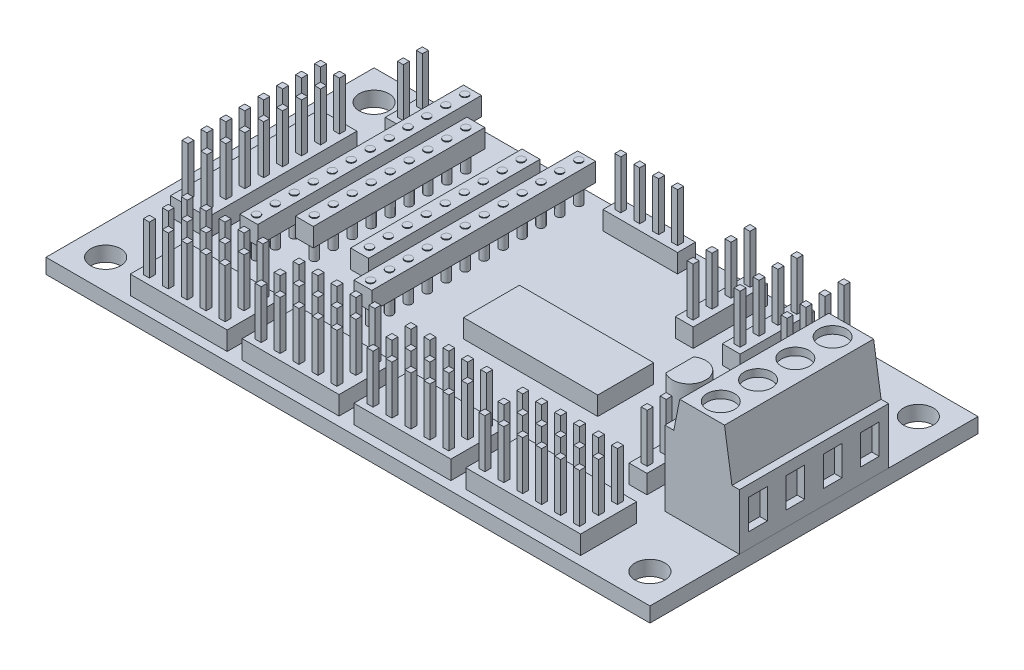
from build123d import *

# Parameters (mm, degrees)
ESQUISSE1_W                = 81
ESQUISSE1_H                = 44
ESQUISSE1_R                = 2
BOSS_EXTRU_1_DEPTH         = 2
BOSS_EXTRU_3_DEPTH         = 10
ESQUISSE5_R                = 1.85
ENL_V_MAT_EXTRU_1_DEPTH    = 1
ESQUISSE6_W                = 2.5
ESQUISSE6_H                = 4
ENL_V_MAT_EXTRU_2_DEPTH    = 1
ESQUISSE4_W                = 5
ESQUISSE4_H                = 20
BOSS_EXTRU_4_DEPTH         = 2.5
ESQUISSE4_W_2              = 2.4
ESQUISSE4_H_2              = 5
BOSS_EXTRU_4_2_DEPTH       = 2.5
ESQUISSE4_H_3              = 30
BOSS_EXTRU_4_3_DEPTH       = 2.5
ESQUISSE4_H_4              = 23
BOSS_EXTRU_4_4_DEPTH       = 2.5
ESQUISSE4_W_3              = 10
ESQUISSE4_H_5              = 2.4
BOSS_EXTRU_4_5_DEPTH       = 2.5
ESQUISSE4_H_6              = 10
BOSS_EXTRU_4_6_DEPTH       = 2.5
BOSS_EXTRU_4_7_DEPTH       = 2.5
BOSS_EXTRU_4_8_DEPTH       = 2.5
ESQUISSE4_W_4              = 13
ESQUISSE4_H_7              = 7.5
BOSS_EXTRU_4_9_DEPTH       = 2.5
BOSS_EXTRU_4_10_DEPTH      = 2.5
BOSS_EXTRU_4_11_DEPTH      = 2.5
ESQUISSE4_W_5              = 15.4
BOSS_EXTRU_4_12_DEPTH      = 2.5
ESQUISSE4_W_6              = 18
BOSS_EXTRU_4_13_DEPTH      = 2.5
BOSS_EXTRU_4_14_DEPTH      = 2.5
BOSS_EXTRU_4_15_DEPTH      = 2.5
BOSS_EXTRU_4_16_DEPTH      = 2.5
BOSS_EXTRU_5_START         = 0.1
ESQUISSE7_R                = 0.5
BOSS_EXTRU_5_DEPTH         = 8
BOSS_EXTRU_5_2_DEPTH       = 8
BOSS_EXTRU_5_3_DEPTH       = 8
BOSS_EXTRU_5_4_DEPTH       = 8
BOSS_EXTRU_5_5_DEPTH       = 8
BOSS_EXTRU_5_6_DEPTH       = 8
BOSS_EXTRU_5_7_DEPTH       = 8
BOSS_EXTRU_5_8_DEPTH       = 8
BOSS_EXTRU_5_9_DEPTH       = 8
BOSS_EXTRU_5_10_DEPTH      = 8
BOSS_EXTRU_5_11_DEPTH      = 8
BOSS_EXTRU_5_12_DEPTH      = 8
BOSS_EXTRU_5_13_DEPTH      = 8
BOSS_EXTRU_5_14_DEPTH      = 8
BOSS_EXTRU_5_15_DEPTH      = 8
BOSS_EXTRU_5_16_DEPTH      = 8
BOSS_EXTRU_5_17_DEPTH      = 8
BOSS_EXTRU_5_18_DEPTH      = 8
BOSS_EXTRU_5_19_DEPTH      = 8
BOSS_EXTRU_5_20_DEPTH      = 8
BOSS_EXTRU_5_21_DEPTH      = 8
BOSS_EXTRU_5_22_DEPTH      = 8
BOSS_EXTRU_5_23_DEPTH      = 8
BOSS_EXTRU_5_24_DEPTH      = 8
BOSS_EXTRU_5_25_DEPTH      = 8
BOSS_EXTRU_5_26_DEPTH      = 8
BOSS_EXTRU_5_27_DEPTH      = 8
BOSS_EXTRU_5_28_DEPTH      = 8
BOSS_EXTRU_5_29_DEPTH      = 8
BOSS_EXTRU_5_30_DEPTH      = 8
BOSS_EXTRU_5_31_DEPTH      = 8
BOSS_EXTRU_5_32_DEPTH      = 8
BOSS_EXTRU_5_33_DEPTH      = 8
BOSS_EXTRU_5_34_DEPTH      = 8
BOSS_EXTRU_5_35_DEPTH      = 8
BOSS_EXTRU_5_36_DEPTH      = 8
BOSS_EXTRU_5_37_DEPTH      = 8
BOSS_EXTRU_5_38_DEPTH      = 8
BOSS_EXTRU_5_39_DEPTH      = 8
BOSS_EXTRU_5_40_DEPTH      = 8
BOSS_EXTRU_5_41_DEPTH      = 8
BOSS_EXTRU_5_42_DEPTH      = 8
BOSS_EXTRU_6_DEPTH         = 8
BOSS_EXTRU_7_START         = 9
ESQUISSE9_W                = 0.8
ESQUISSE9_H                = 0.8
BOSS_EXTRU_7_DEPTH         = 12
BOSS_EXTRU_7_2_DEPTH       = 12
BOSS_EXTRU_7_3_DEPTH       = 12
BOSS_EXTRU_7_4_DEPTH       = 12
BOSS_EXTRU_7_5_DEPTH       = 12
BOSS_EXTRU_7_6_DEPTH       = 12
BOSS_EXTRU_7_7_DEPTH       = 12
BOSS_EXTRU_7_8_DEPTH       = 12
BOSS_EXTRU_7_9_DEPTH       = 12
BOSS_EXTRU_7_10_DEPTH      = 12
BOSS_EXTRU_7_11_DEPTH      = 12
BOSS_EXTRU_7_12_DEPTH      = 12
BOSS_EXTRU_7_13_DEPTH      = 12
BOSS_EXTRU_7_14_DEPTH      = 12
BOSS_EXTRU_7_15_DEPTH      = 12
BOSS_EXTRU_7_16_DEPTH      = 12
BOSS_EXTRU_7_17_DEPTH      = 12
BOSS_EXTRU_7_18_DEPTH      = 12
BOSS_EXTRU_7_19_DEPTH      = 12
BOSS_EXTRU_7_20_DEPTH      = 12
BOSS_EXTRU_7_21_DEPTH      = 12
BOSS_EXTRU_7_22_DEPTH      = 12
BOSS_EXTRU_7_23_DEPTH      = 12
BOSS_EXTRU_7_24_DEPTH      = 12
BOSS_EXTRU_7_25_DEPTH      = 12
BOSS_EXTRU_7_26_DEPTH      = 12
BOSS_EXTRU_7_27_DEPTH      = 12
BOSS_EXTRU_7_28_DEPTH      = 12
BOSS_EXTRU_7_29_DEPTH      = 12
BOSS_EXTRU_7_30_DEPTH      = 12
BOSS_EXTRU_7_31_DEPTH      = 12
BOSS_EXTRU_7_32_DEPTH      = 12
BOSS_EXTRU_7_33_DEPTH      = 12
BOSS_EXTRU_7_34_DEPTH      = 12
BOSS_EXTRU_7_35_DEPTH      = 12
BOSS_EXTRU_7_36_DEPTH      = 12
BOSS_EXTRU_7_37_DEPTH      = 12
BOSS_EXTRU_7_38_DEPTH      = 12
BOSS_EXTRU_7_39_DEPTH      = 12
BOSS_EXTRU_7_40_DEPTH      = 12
BOSS_EXTRU_7_41_DEPTH      = 12
BOSS_EXTRU_7_42_DEPTH      = 12
BOSS_EXTRU_7_43_DEPTH      = 12
BOSS_EXTRU_7_44_DEPTH      = 12
BOSS_EXTRU_7_45_DEPTH      = 12
BOSS_EXTRU_7_46_DEPTH      = 12
BOSS_EXTRU_7_47_DEPTH      = 12
BOSS_EXTRU_7_48_DEPTH      = 12
BOSS_EXTRU_7_49_DEPTH      = 12
BOSS_EXTRU_7_50_DEPTH      = 12
BOSS_EXTRU_7_51_DEPTH      = 12
BOSS_EXTRU_7_52_DEPTH      = 12
BOSS_EXTRU_7_53_DEPTH      = 12
BOSS_EXTRU_7_54_DEPTH      = 12
R_P_TITION_LIN_AIRE1_COUNT = 4
R_P_TITION_LIN_AIRE1_PITCH = 15


with BuildPart() as part:
    # Esquisse1 → Boss.-Extru.1 (new body)
    with BuildSketch(Plane(origin=(0, 0, 0), x_dir=(1, 0, 0), z_dir=(0, 1, 0))):
        Rectangle(ESQUISSE1_W, ESQUISSE1_H)
        with Locations(Location((-36.5, 18, 0), (0, 0, 270))):
            Circle(ESQUISSE1_R, mode=Mode.SUBTRACT)
        with Locations(Location((36.5, 18, 0), (0, 0, 90))):
            Circle(ESQUISSE1_R, mode=Mode.SUBTRACT)
        with Locations(Location((-36.5, -18, 0), (0, 0, 90))):
            Circle(ESQUISSE1_R, mode=Mode.SUBTRACT)
        with Locations(Location((36.5, -18, 0), (0, 0, 270))):
            Circle(ESQUISSE1_R, mode=Mode.SUBTRACT)
    extrude(amount=BOSS_EXTRU_1_DEPTH)


with BuildPart() as body_2:
    # Esquisse3 → Boss.-Extru.3 (new, symmetric)
    with BuildSketch(Plane.XY):
        Polygon((30.5, 2), (30.5, 12), (31.7, 12), (32.5, 16), (38.5, 16), (39.5, 9.5), (40.5, 9.5), (40.5, 2), align=None)
    extrude(amount=BOSS_EXTRU_3_DEPTH, both=True)

    # Esquisse5 → Enlèv. mat.-Extru.1 (cut)
    with BuildSketch(Plane(origin=(0, 16, 0), x_dir=(1, 0, 0), z_dir=(0, 1, 0))):
        with Locations(Location((35.5, -7.5, 0), (0, 0, 270))):
            Circle(ESQUISSE5_R)
        with Locations(Location((35.5, -2.5, 0), (0, 0, 270))):
            Circle(ESQUISSE5_R)
        with Locations(Location((35.5, 2.5, 0), (0, 0, 270))):
            Circle(ESQUISSE5_R)
        with Locations(Location((35.5, 7.5, 0), (0, 0, 270))):
            Circle(ESQUISSE5_R)
    extrude(amount=-ENL_V_MAT_EXTRU_1_DEPTH, mode=Mode.SUBTRACT)

    # Esquisse6 → Enlèv. mat.-Extru.2 (cut)
    with BuildSketch(Plane(origin=(40.5, 0, 0), x_dir=(0, 0, -1), z_dir=(1, 0, 0))):
        with Locations((-2.5, 6)):
            Rectangle(ESQUISSE6_W, ESQUISSE6_H)
        with Locations((-7.5, 6)):
            Rectangle(ESQUISSE6_W, ESQUISSE6_H)
        with Locations((2.5, 6)):
            Rectangle(ESQUISSE6_W, ESQUISSE6_H)
        with Locations((7.5, 6)):
            Rectangle(ESQUISSE6_W, ESQUISSE6_H)
    extrude(amount=-ENL_V_MAT_EXTRU_2_DEPTH, mode=Mode.SUBTRACT)


with BuildPart() as body_3:
    # Esquisse4 → Boss.-Extru.4 (new body)
    with BuildSketch(Plane(origin=(0, 2, 0), x_dir=(1, 0, 0), z_dir=(0, 1, 0))):
        with Locations((-34.3, 1)):
            Rectangle(ESQUISSE4_W, ESQUISSE4_H)
    extrude(amount=BOSS_EXTRU_4_DEPTH)


with BuildPart() as body_4:
    # Esquisse4 → Boss.-Extru.4 2 (new body)
    with BuildSketch(Plane(origin=(0, 2, 0), x_dir=(1, 0, 0), z_dir=(0, 1, 0))):
        with Locations((-30.3, 17)):
            Rectangle(ESQUISSE4_W_2, ESQUISSE4_H_2)
    extrude(amount=BOSS_EXTRU_4_2_DEPTH)


with BuildPart() as body_5:
    # Esquisse4 → Boss.-Extru.4 3 (new body)
    with BuildSketch(Plane(origin=(0, 2, 0), x_dir=(1, 0, 0), z_dir=(0, 1, 0))):
        with Locations((-26.3, 6)):
            Rectangle(ESQUISSE4_W_2, ESQUISSE4_H_3)
    extrude(amount=BOSS_EXTRU_4_3_DEPTH)


with BuildPart() as body_6:
    # Esquisse4 → Boss.-Extru.4 4 (new body)
    with BuildSketch(Plane(origin=(0, 2, 0), x_dir=(1, 0, 0), z_dir=(0, 1, 0))):
        with Locations((-22.35, 6)):
            Rectangle(ESQUISSE4_W_2, ESQUISSE4_H_4)
    extrude(amount=BOSS_EXTRU_4_4_DEPTH)


with BuildPart() as body_7:
    # Esquisse4 → Boss.-Extru.4 5 (new body)
    with BuildSketch(Plane(origin=(0, 2, 0), x_dir=(1, 0, 0), z_dir=(0, 1, 0))):
        with Locations((-1.2, 19.6)):
            Rectangle(ESQUISSE4_W_3, ESQUISSE4_H_5)
    extrude(amount=BOSS_EXTRU_4_5_DEPTH)


with BuildPart() as body_8:
    # Esquisse4 → Boss.-Extru.4 6 (new body)
    with BuildSketch(Plane(origin=(0, 2, 0), x_dir=(1, 0, 0), z_dir=(0, 1, 0))):
        with Locations((12.3, 15.8)):
            Rectangle(ESQUISSE4_W_2, ESQUISSE4_H_6)
    extrude(amount=BOSS_EXTRU_4_6_DEPTH)


with BuildPart() as body_9:
    # Esquisse4 → Boss.-Extru.4 7 (new body)
    with BuildSketch(Plane(origin=(0, 2, 0), x_dir=(1, 0, 0), z_dir=(0, 1, 0))):
        with Locations((18.6, 15.8)):
            Rectangle(ESQUISSE4_W_2, ESQUISSE4_H_6)
    extrude(amount=BOSS_EXTRU_4_7_DEPTH)


with BuildPart() as body_10:
    # Esquisse4 → Boss.-Extru.4 8 (new body)
    with BuildSketch(Plane(origin=(0, 2, 0), x_dir=(1, 0, 0), z_dir=(0, 1, 0))):
        with Locations((24.9, 15.8)):
            Rectangle(ESQUISSE4_W_2, ESQUISSE4_H_6)
    extrude(amount=BOSS_EXTRU_4_8_DEPTH)


with BuildPart() as body_11:
    # Esquisse4 → Boss.-Extru.4 9 (new body)
    with BuildSketch(Plane(origin=(0, 2, 0), x_dir=(1, 0, 0), z_dir=(0, 1, 0))):
        with Locations((-23.9, -17.05)):
            Rectangle(ESQUISSE4_W_4, ESQUISSE4_H_7)
    extrude(amount=BOSS_EXTRU_4_9_DEPTH)


with BuildPart() as body_12:
    # Esquisse4 → Boss.-Extru.4 10 (new body)
    with BuildSketch(Plane(origin=(0, 2, 0), x_dir=(1, 0, 0), z_dir=(0, 1, 0))):
        with Locations((-8.9, -17.05)):
            Rectangle(ESQUISSE4_W_4, ESQUISSE4_H_7)
    extrude(amount=BOSS_EXTRU_4_10_DEPTH)


with BuildPart() as body_13:
    # Esquisse4 → Boss.-Extru.4 11 (new body)
    with BuildSketch(Plane(origin=(0, 2, 0), x_dir=(1, 0, 0), z_dir=(0, 1, 0))):
        with Locations((6.1, -17.05)):
            Rectangle(ESQUISSE4_W_4, ESQUISSE4_H_7)
    extrude(amount=BOSS_EXTRU_4_11_DEPTH)


with BuildPart() as body_14:
    # Esquisse4 → Boss.-Extru.4 12 (new body)
    with BuildSketch(Plane(origin=(0, 2, 0), x_dir=(1, 0, 0), z_dir=(0, 1, 0))):
        with Locations((22.3, -17.05)):
            Rectangle(ESQUISSE4_W_5, ESQUISSE4_H_7)
    extrude(amount=BOSS_EXTRU_4_12_DEPTH)


with BuildPart() as body_15:
    # Esquisse4 → Boss.-Extru.4 13 (new body)
    with BuildSketch(Plane(origin=(0, 2, 0), x_dir=(1, 0, 0), z_dir=(0, 1, 0))):
        with Locations((6, 0.25)):
            Rectangle(ESQUISSE4_W_6, ESQUISSE4_H_7)
    extrude(amount=BOSS_EXTRU_4_13_DEPTH)


with BuildPart() as body_16:
    # Esquisse4 → Boss.-Extru.4 14 (new body)
    with BuildSketch(Plane(origin=(0, 2, 0), x_dir=(1, 0, 0), z_dir=(0, 1, 0))):
        with Locations((26.2, -6.8)):
            Rectangle(ESQUISSE4_W_2, ESQUISSE4_H_2)
    extrude(amount=BOSS_EXTRU_4_14_DEPTH)


with BuildPart() as body_17:
    # Esquisse4 → Boss.-Extru.4 15 (new body)
    with BuildSketch(Plane(origin=(0, 2, 0), x_dir=(1, 0, 0), z_dir=(0, 1, 0))):
        with Locations((-14.95, 6)):
            Rectangle(ESQUISSE4_W_2, ESQUISSE4_H_4)
    extrude(amount=BOSS_EXTRU_4_15_DEPTH)


with BuildPart() as body_18:
    # Esquisse4 → Boss.-Extru.4 16 (new body)
    with BuildSketch(Plane(origin=(0, 2, 0), x_dir=(1, 0, 0), z_dir=(0, 1, 0))):
        with Locations((-11, 6)):
            Rectangle(ESQUISSE4_W_2, ESQUISSE4_H_3)
    extrude(amount=BOSS_EXTRU_4_16_DEPTH)


with BuildPart() as body_18_1:
    # Corps-Déplacer/Copier1: moved
    add(body_18.part.moved(Location((0, 2.5, 0))))


with BuildPart() as body_17_1:
    # Corps-Déplacer/Copier1: moved
    add(body_17.part.moved(Location((0, 2.5, 0))))


with BuildPart() as body_6_1:
    # Corps-Déplacer/Copier1: moved
    add(body_6.part.moved(Location((0, 2.5, 0))))


with BuildPart() as body_5_1:
    # Corps-Déplacer/Copier1: moved
    add(body_5.part.moved(Location((0, 2.5, 0))))


with BuildPart() as body_19:
    # Esquisse7 → Boss.-Extru.5 (new body)
    with BuildSketch(Plane(origin=(0, 7, 0), x_dir=(1, 0, 0), z_dir=(0, 1, 0)).offset(BOSS_EXTRU_5_START)):
        with Locations(Location((-26.3, -7.97, 0), (0, 0, 270))):
            Circle(ESQUISSE7_R)
    extrude(amount=-BOSS_EXTRU_5_DEPTH)


with BuildPart() as body_20:
    # Esquisse7 → Boss.-Extru.5 2 (new body)
    with BuildSketch(Plane(origin=(0, 7, 0), x_dir=(1, 0, 0), z_dir=(0, 1, 0)).offset(BOSS_EXTRU_5_START)):
        with Locations(Location((-22.35, -4.16, 0), (0, 0, 270))):
            Circle(ESQUISSE7_R)
    extrude(amount=-BOSS_EXTRU_5_2_DEPTH)


with BuildPart() as body_21:
    # Esquisse7 → Boss.-Extru.5 3 (new body)
    with BuildSketch(Plane(origin=(0, 7, 0), x_dir=(1, 0, 0), z_dir=(0, 1, 0)).offset(BOSS_EXTRU_5_START)):
        with Locations(Location((-26.3, -5.43, 0), (0, 0, 270))):
            Circle(ESQUISSE7_R)
    extrude(amount=-BOSS_EXTRU_5_3_DEPTH)


with BuildPart() as body_22:
    # Esquisse7 → Boss.-Extru.5 4 (new body)
    with BuildSketch(Plane(origin=(0, 7, 0), x_dir=(1, 0, 0), z_dir=(0, 1, 0)).offset(BOSS_EXTRU_5_START)):
        with Locations(Location((-26.3, -2.89, 0), (0, 0, 270))):
            Circle(ESQUISSE7_R)
    extrude(amount=-BOSS_EXTRU_5_4_DEPTH)


with BuildPart() as body_23:
    # Esquisse7 → Boss.-Extru.5 5 (new body)
    with BuildSketch(Plane(origin=(0, 7, 0), x_dir=(1, 0, 0), z_dir=(0, 1, 0)).offset(BOSS_EXTRU_5_START)):
        with Locations(Location((-26.3, -0.35, 0), (0, 0, 270))):
            Circle(ESQUISSE7_R)
    extrude(amount=-BOSS_EXTRU_5_5_DEPTH)


with BuildPart() as body_24:
    # Esquisse7 → Boss.-Extru.5 6 (new body)
    with BuildSketch(Plane(origin=(0, 7, 0), x_dir=(1, 0, 0), z_dir=(0, 1, 0)).offset(BOSS_EXTRU_5_START)):
        with Locations(Location((-22.35, -1.62, 0), (0, 0, 270))):
            Circle(ESQUISSE7_R)
    extrude(amount=-BOSS_EXTRU_5_6_DEPTH)


with BuildPart() as body_25:
    # Esquisse7 → Boss.-Extru.5 7 (new body)
    with BuildSketch(Plane(origin=(0, 7, 0), x_dir=(1, 0, 0), z_dir=(0, 1, 0)).offset(BOSS_EXTRU_5_START)):
        with Locations(Location((-22.35, 0.92, 0), (0, 0, 270))):
            Circle(ESQUISSE7_R)
    extrude(amount=-BOSS_EXTRU_5_7_DEPTH)


with BuildPart() as body_26:
    # Esquisse7 → Boss.-Extru.5 8 (new body)
    with BuildSketch(Plane(origin=(0, 7, 0), x_dir=(1, 0, 0), z_dir=(0, 1, 0)).offset(BOSS_EXTRU_5_START)):
        with Locations(Location((-22.35, 3.46, 0), (0, 0, 270))):
            Circle(ESQUISSE7_R)
    extrude(amount=-BOSS_EXTRU_5_8_DEPTH)


with BuildPart() as body_27:
    # Esquisse7 → Boss.-Extru.5 9 (new body)
    with BuildSketch(Plane(origin=(0, 7, 0), x_dir=(1, 0, 0), z_dir=(0, 1, 0)).offset(BOSS_EXTRU_5_START)):
        with Locations(Location((-26.3, 2.19, 0), (0, 0, 270))):
            Circle(ESQUISSE7_R)
    extrude(amount=-BOSS_EXTRU_5_9_DEPTH)


with BuildPart() as body_28:
    # Esquisse7 → Boss.-Extru.5 10 (new body)
    with BuildSketch(Plane(origin=(0, 7, 0), x_dir=(1, 0, 0), z_dir=(0, 1, 0)).offset(BOSS_EXTRU_5_START)):
        with Locations(Location((-26.3, 4.73, 0), (0, 0, 270))):
            Circle(ESQUISSE7_R)
    extrude(amount=-BOSS_EXTRU_5_10_DEPTH)


with BuildPart() as body_29:
    # Esquisse7 → Boss.-Extru.5 11 (new body)
    with BuildSketch(Plane(origin=(0, 7, 0), x_dir=(1, 0, 0), z_dir=(0, 1, 0)).offset(BOSS_EXTRU_5_START)):
        with Locations(Location((-26.3, 7.27, 0), (0, 0, 270))):
            Circle(ESQUISSE7_R)
    extrude(amount=-BOSS_EXTRU_5_11_DEPTH)


with BuildPart() as body_30:
    # Esquisse7 → Boss.-Extru.5 12 (new body)
    with BuildSketch(Plane(origin=(0, 7, 0), x_dir=(1, 0, 0), z_dir=(0, 1, 0)).offset(BOSS_EXTRU_5_START)):
        with Locations(Location((-26.3, 9.81, 0), (0, 0, 270))):
            Circle(ESQUISSE7_R)
    extrude(amount=-BOSS_EXTRU_5_12_DEPTH)


with BuildPart() as body_31:
    # Esquisse7 → Boss.-Extru.5 13 (new body)
    with BuildSketch(Plane(origin=(0, 7, 0), x_dir=(1, 0, 0), z_dir=(0, 1, 0)).offset(BOSS_EXTRU_5_START)):
        with Locations(Location((-26.3, 12.35, 0), (0, 0, 270))):
            Circle(ESQUISSE7_R)
    extrude(amount=-BOSS_EXTRU_5_13_DEPTH)


with BuildPart() as body_32:
    # Esquisse7 → Boss.-Extru.5 14 (new body)
    with BuildSketch(Plane(origin=(0, 7, 0), x_dir=(1, 0, 0), z_dir=(0, 1, 0)).offset(BOSS_EXTRU_5_START)):
        with Locations(Location((-26.3, 14.89, 0), (0, 0, 270))):
            Circle(ESQUISSE7_R)
    extrude(amount=-BOSS_EXTRU_5_14_DEPTH)


with BuildPart() as body_33:
    # Esquisse7 → Boss.-Extru.5 15 (new body)
    with BuildSketch(Plane(origin=(0, 7, 0), x_dir=(1, 0, 0), z_dir=(0, 1, 0)).offset(BOSS_EXTRU_5_START)):
        with Locations(Location((-26.3, 17.43, 0), (0, 0, 270))):
            Circle(ESQUISSE7_R)
    extrude(amount=-BOSS_EXTRU_5_15_DEPTH)


with BuildPart() as body_34:
    # Esquisse7 → Boss.-Extru.5 16 (new body)
    with BuildSketch(Plane(origin=(0, 7, 0), x_dir=(1, 0, 0), z_dir=(0, 1, 0)).offset(BOSS_EXTRU_5_START)):
        with Locations(Location((-26.3, 19.97, 0), (0, 0, 270))):
            Circle(ESQUISSE7_R)
    extrude(amount=-BOSS_EXTRU_5_16_DEPTH)


with BuildPart() as body_35:
    # Esquisse7 → Boss.-Extru.5 17 (new body)
    with BuildSketch(Plane(origin=(0, 7, 0), x_dir=(1, 0, 0), z_dir=(0, 1, 0)).offset(BOSS_EXTRU_5_START)):
        with Locations(Location((-22.35, 6, 0), (0, 0, 270))):
            Circle(ESQUISSE7_R)
    extrude(amount=-BOSS_EXTRU_5_17_DEPTH)


with BuildPart() as body_36:
    # Esquisse7 → Boss.-Extru.5 18 (new body)
    with BuildSketch(Plane(origin=(0, 7, 0), x_dir=(1, 0, 0), z_dir=(0, 1, 0)).offset(BOSS_EXTRU_5_START)):
        with Locations(Location((-22.35, 8.54, 0), (0, 0, 270))):
            Circle(ESQUISSE7_R)
    extrude(amount=-BOSS_EXTRU_5_18_DEPTH)


with BuildPart() as body_37:
    # Esquisse7 → Boss.-Extru.5 19 (new body)
    with BuildSketch(Plane(origin=(0, 7, 0), x_dir=(1, 0, 0), z_dir=(0, 1, 0)).offset(BOSS_EXTRU_5_START)):
        with Locations(Location((-22.35, 11.08, 0), (0, 0, 270))):
            Circle(ESQUISSE7_R)
    extrude(amount=-BOSS_EXTRU_5_19_DEPTH)


with BuildPart() as body_38:
    # Esquisse7 → Boss.-Extru.5 20 (new body)
    with BuildSketch(Plane(origin=(0, 7, 0), x_dir=(1, 0, 0), z_dir=(0, 1, 0)).offset(BOSS_EXTRU_5_START)):
        with Locations(Location((-22.35, 13.62, 0), (0, 0, 270))):
            Circle(ESQUISSE7_R)
    extrude(amount=-BOSS_EXTRU_5_20_DEPTH)


with BuildPart() as body_39:
    # Esquisse7 → Boss.-Extru.5 21 (new body)
    with BuildSketch(Plane(origin=(0, 7, 0), x_dir=(1, 0, 0), z_dir=(0, 1, 0)).offset(BOSS_EXTRU_5_START)):
        with Locations(Location((-22.35, 16.16, 0), (0, 0, 270))):
            Circle(ESQUISSE7_R)
    extrude(amount=-BOSS_EXTRU_5_21_DEPTH)


with BuildPart() as body_40:
    # Esquisse7 → Boss.-Extru.5 22 (new body)
    with BuildSketch(Plane(origin=(0, 7, 0), x_dir=(1, 0, 0), z_dir=(0, 1, 0)).offset(BOSS_EXTRU_5_START)):
        with Locations(Location((-11, -7.97, 0), (0, 0, 90))):
            Circle(ESQUISSE7_R)
    extrude(amount=-BOSS_EXTRU_5_22_DEPTH)


with BuildPart() as body_41:
    # Esquisse7 → Boss.-Extru.5 23 (new body)
    with BuildSketch(Plane(origin=(0, 7, 0), x_dir=(1, 0, 0), z_dir=(0, 1, 0)).offset(BOSS_EXTRU_5_START)):
        with Locations(Location((-14.95, -4.16, 0), (0, 0, 90))):
            Circle(ESQUISSE7_R)
    extrude(amount=-BOSS_EXTRU_5_23_DEPTH)


with BuildPart() as body_42:
    # Esquisse7 → Boss.-Extru.5 24 (new body)
    with BuildSketch(Plane(origin=(0, 7, 0), x_dir=(1, 0, 0), z_dir=(0, 1, 0)).offset(BOSS_EXTRU_5_START)):
        with Locations(Location((-11, -5.43, 0), (0, 0, 90))):
            Circle(ESQUISSE7_R)
    extrude(amount=-BOSS_EXTRU_5_24_DEPTH)


with BuildPart() as body_43:
    # Esquisse7 → Boss.-Extru.5 25 (new body)
    with BuildSketch(Plane(origin=(0, 7, 0), x_dir=(1, 0, 0), z_dir=(0, 1, 0)).offset(BOSS_EXTRU_5_START)):
        with Locations(Location((-11, -2.89, 0), (0, 0, 90))):
            Circle(ESQUISSE7_R)
    extrude(amount=-BOSS_EXTRU_5_25_DEPTH)


with BuildPart() as body_44:
    # Esquisse7 → Boss.-Extru.5 26 (new body)
    with BuildSketch(Plane(origin=(0, 7, 0), x_dir=(1, 0, 0), z_dir=(0, 1, 0)).offset(BOSS_EXTRU_5_START)):
        with Locations(Location((-11, -0.35, 0), (0, 0, 90))):
            Circle(ESQUISSE7_R)
    extrude(amount=-BOSS_EXTRU_5_26_DEPTH)


with BuildPart() as body_45:
    # Esquisse7 → Boss.-Extru.5 27 (new body)
    with BuildSketch(Plane(origin=(0, 7, 0), x_dir=(1, 0, 0), z_dir=(0, 1, 0)).offset(BOSS_EXTRU_5_START)):
        with Locations(Location((-11, 2.19, 0), (0, 0, 90))):
            Circle(ESQUISSE7_R)
    extrude(amount=-BOSS_EXTRU_5_27_DEPTH)


with BuildPart() as body_46:
    # Esquisse7 → Boss.-Extru.5 28 (new body)
    with BuildSketch(Plane(origin=(0, 7, 0), x_dir=(1, 0, 0), z_dir=(0, 1, 0)).offset(BOSS_EXTRU_5_START)):
        with Locations(Location((-11, 4.73, 0), (0, 0, 90))):
            Circle(ESQUISSE7_R)
    extrude(amount=-BOSS_EXTRU_5_28_DEPTH)


with BuildPart() as body_47:
    # Esquisse7 → Boss.-Extru.5 29 (new body)
    with BuildSketch(Plane(origin=(0, 7, 0), x_dir=(1, 0, 0), z_dir=(0, 1, 0)).offset(BOSS_EXTRU_5_START)):
        with Locations(Location((-11, 7.27, 0), (0, 0, 90))):
            Circle(ESQUISSE7_R)
    extrude(amount=-BOSS_EXTRU_5_29_DEPTH)


with BuildPart() as body_48:
    # Esquisse7 → Boss.-Extru.5 30 (new body)
    with BuildSketch(Plane(origin=(0, 7, 0), x_dir=(1, 0, 0), z_dir=(0, 1, 0)).offset(BOSS_EXTRU_5_START)):
        with Locations(Location((-11, 9.81, 0), (0, 0, 90))):
            Circle(ESQUISSE7_R)
    extrude(amount=-BOSS_EXTRU_5_30_DEPTH)


with BuildPart() as body_49:
    # Esquisse7 → Boss.-Extru.5 31 (new body)
    with BuildSketch(Plane(origin=(0, 7, 0), x_dir=(1, 0, 0), z_dir=(0, 1, 0)).offset(BOSS_EXTRU_5_START)):
        with Locations(Location((-11, 12.35, 0), (0, 0, 90))):
            Circle(ESQUISSE7_R)
    extrude(amount=-BOSS_EXTRU_5_31_DEPTH)


with BuildPart() as body_50:
    # Esquisse7 → Boss.-Extru.5 32 (new body)
    with BuildSketch(Plane(origin=(0, 7, 0), x_dir=(1, 0, 0), z_dir=(0, 1, 0)).offset(BOSS_EXTRU_5_START)):
        with Locations(Location((-11, 14.89, 0), (0, 0, 90))):
            Circle(ESQUISSE7_R)
    extrude(amount=-BOSS_EXTRU_5_32_DEPTH)


with BuildPart() as body_51:
    # Esquisse7 → Boss.-Extru.5 33 (new body)
    with BuildSketch(Plane(origin=(0, 7, 0), x_dir=(1, 0, 0), z_dir=(0, 1, 0)).offset(BOSS_EXTRU_5_START)):
        with Locations(Location((-11, 17.43, 0), (0, 0, 90))):
            Circle(ESQUISSE7_R)
    extrude(amount=-BOSS_EXTRU_5_33_DEPTH)


with BuildPart() as body_52:
    # Esquisse7 → Boss.-Extru.5 34 (new body)
    with BuildSketch(Plane(origin=(0, 7, 0), x_dir=(1, 0, 0), z_dir=(0, 1, 0)).offset(BOSS_EXTRU_5_START)):
        with Locations(Location((-11, 19.97, 0), (0, 0, 90))):
            Circle(ESQUISSE7_R)
    extrude(amount=-BOSS_EXTRU_5_34_DEPTH)


with BuildPart() as body_53:
    # Esquisse7 → Boss.-Extru.5 35 (new body)
    with BuildSketch(Plane(origin=(0, 7, 0), x_dir=(1, 0, 0), z_dir=(0, 1, 0)).offset(BOSS_EXTRU_5_START)):
        with Locations(Location((-14.95, -1.62, 0), (0, 0, 90))):
            Circle(ESQUISSE7_R)
    extrude(amount=-BOSS_EXTRU_5_35_DEPTH)


with BuildPart() as body_54:
    # Esquisse7 → Boss.-Extru.5 36 (new body)
    with BuildSketch(Plane(origin=(0, 7, 0), x_dir=(1, 0, 0), z_dir=(0, 1, 0)).offset(BOSS_EXTRU_5_START)):
        with Locations(Location((-14.95, 0.92, 0), (0, 0, 90))):
            Circle(ESQUISSE7_R)
    extrude(amount=-BOSS_EXTRU_5_36_DEPTH)


with BuildPart() as body_55:
    # Esquisse7 → Boss.-Extru.5 37 (new body)
    with BuildSketch(Plane(origin=(0, 7, 0), x_dir=(1, 0, 0), z_dir=(0, 1, 0)).offset(BOSS_EXTRU_5_START)):
        with Locations(Location((-14.95, 3.46, 0), (0, 0, 90))):
            Circle(ESQUISSE7_R)
    extrude(amount=-BOSS_EXTRU_5_37_DEPTH)


with BuildPart() as body_56:
    # Esquisse7 → Boss.-Extru.5 38 (new body)
    with BuildSketch(Plane(origin=(0, 7, 0), x_dir=(1, 0, 0), z_dir=(0, 1, 0)).offset(BOSS_EXTRU_5_START)):
        with Locations(Location((-14.95, 6, 0), (0, 0, 90))):
            Circle(ESQUISSE7_R)
    extrude(amount=-BOSS_EXTRU_5_38_DEPTH)


with BuildPart() as body_57:
    # Esquisse7 → Boss.-Extru.5 39 (new body)
    with BuildSketch(Plane(origin=(0, 7, 0), x_dir=(1, 0, 0), z_dir=(0, 1, 0)).offset(BOSS_EXTRU_5_START)):
        with Locations(Location((-14.95, 8.54, 0), (0, 0, 90))):
            Circle(ESQUISSE7_R)
    extrude(amount=-BOSS_EXTRU_5_39_DEPTH)


with BuildPart() as body_58:
    # Esquisse7 → Boss.-Extru.5 40 (new body)
    with BuildSketch(Plane(origin=(0, 7, 0), x_dir=(1, 0, 0), z_dir=(0, 1, 0)).offset(BOSS_EXTRU_5_START)):
        with Locations(Location((-14.95, 11.08, 0), (0, 0, 90))):
            Circle(ESQUISSE7_R)
    extrude(amount=-BOSS_EXTRU_5_40_DEPTH)


with BuildPart() as body_59:
    # Esquisse7 → Boss.-Extru.5 41 (new body)
    with BuildSketch(Plane(origin=(0, 7, 0), x_dir=(1, 0, 0), z_dir=(0, 1, 0)).offset(BOSS_EXTRU_5_START)):
        with Locations(Location((-14.95, 13.62, 0), (0, 0, 90))):
            Circle(ESQUISSE7_R)
    extrude(amount=-BOSS_EXTRU_5_41_DEPTH)


with BuildPart() as body_60:
    # Esquisse7 → Boss.-Extru.5 42 (new body)
    with BuildSketch(Plane(origin=(0, 7, 0), x_dir=(1, 0, 0), z_dir=(0, 1, 0)).offset(BOSS_EXTRU_5_START)):
        with Locations(Location((-14.95, 16.16, 0), (0, 0, 90))):
            Circle(ESQUISSE7_R)
    extrude(amount=-BOSS_EXTRU_5_42_DEPTH)


with BuildPart() as body_61:
    # Esquisse8 → Boss.-Extru.6 (new body)
    with BuildSketch(Plane(origin=(0, 2, 0), x_dir=(1, 0, 0), z_dir=(0, 1, 0))):
        with BuildLine():
            Line((22.5, 1.870828693), (22.5, -1.870828693))
            ThreePointArc((22.5, -1.870828693), (26, 0), (22.5, 1.870828693))
        make_face()
    extrude(amount=BOSS_EXTRU_6_DEPTH)


with BuildPart() as body_62:
    # Esquisse9 → Boss.-Extru.7 (new body)
    with BuildSketch(Plane(origin=(0, 2, 0), x_dir=(1, 0, 0), z_dir=(0, 1, 0)).offset(BOSS_EXTRU_7_START)):
        with Locations((18.6, 11.99)):
            Rectangle(ESQUISSE9_W, ESQUISSE9_H)
    extrude(amount=-BOSS_EXTRU_7_DEPTH)


with BuildPart() as body_63:
    # Esquisse9 → Boss.-Extru.7 2 (new body)
    with BuildSketch(Plane(origin=(0, 2, 0), x_dir=(1, 0, 0), z_dir=(0, 1, 0)).offset(BOSS_EXTRU_7_START)):
        with Locations((12.3, 11.99)):
            Rectangle(ESQUISSE9_W, ESQUISSE9_H)
    extrude(amount=-BOSS_EXTRU_7_2_DEPTH)


with BuildPart() as body_64:
    # Esquisse9 → Boss.-Extru.7 3 (new body)
    with BuildSketch(Plane(origin=(0, 2, 0), x_dir=(1, 0, 0), z_dir=(0, 1, 0)).offset(BOSS_EXTRU_7_START)):
        with Locations((-30.3, 18.27)):
            Rectangle(ESQUISSE9_W, ESQUISSE9_H)
    extrude(amount=-BOSS_EXTRU_7_3_DEPTH)


with BuildPart() as body_65:
    # Esquisse9 → Boss.-Extru.7 4 (new body)
    with BuildSketch(Plane(origin=(0, 2, 0), x_dir=(1, 0, 0), z_dir=(0, 1, 0)).offset(BOSS_EXTRU_7_START)):
        with Locations((-35.57, 9.89)):
            Rectangle(ESQUISSE9_W, ESQUISSE9_H)
    extrude(amount=-BOSS_EXTRU_7_4_DEPTH)


with BuildPart() as body_66:
    # Esquisse9 → Boss.-Extru.7 5 (new body)
    with BuildSketch(Plane(origin=(0, 2, 0), x_dir=(1, 0, 0), z_dir=(0, 1, 0)).offset(BOSS_EXTRU_7_START)):
        with Locations((26.2, -5.53)):
            Rectangle(ESQUISSE9_W, ESQUISSE9_H)
    extrude(amount=-BOSS_EXTRU_7_5_DEPTH)


with BuildPart() as body_67:
    # Esquisse9 → Boss.-Extru.7 6 (new body)
    with BuildSketch(Plane(origin=(0, 2, 0), x_dir=(1, 0, 0), z_dir=(0, 1, 0)).offset(BOSS_EXTRU_7_START)):
        with Locations((15.95, -19.59)):
            Rectangle(ESQUISSE9_W, ESQUISSE9_H)
    extrude(amount=-BOSS_EXTRU_7_6_DEPTH)


with BuildPart() as body_68:
    # Esquisse9 → Boss.-Extru.7 7 (new body)
    with BuildSketch(Plane(origin=(0, 2, 0), x_dir=(1, 0, 0), z_dir=(0, 1, 0)).offset(BOSS_EXTRU_7_START)):
        with Locations((-5.01, 19.6)):
            Rectangle(ESQUISSE9_W, ESQUISSE9_H)
    extrude(amount=-BOSS_EXTRU_7_7_DEPTH)


with BuildPart() as body_69:
    # Esquisse9 → Boss.-Extru.7 8 (new body)
    with BuildSketch(Plane(origin=(0, 2, 0), x_dir=(1, 0, 0), z_dir=(0, 1, 0)).offset(BOSS_EXTRU_7_START)):
        with Locations((24.9, 11.99)):
            Rectangle(ESQUISSE9_W, ESQUISSE9_H)
    extrude(amount=-BOSS_EXTRU_7_8_DEPTH)


with BuildPart() as body_70:
    # Esquisse9 → Boss.-Extru.7 9 (new body)
    with BuildSketch(Plane(origin=(0, 2, 0), x_dir=(1, 0, 0), z_dir=(0, 1, 0)).offset(BOSS_EXTRU_7_START)):
        with Locations((18.6, 14.53)):
            Rectangle(ESQUISSE9_W, ESQUISSE9_H)
    extrude(amount=-BOSS_EXTRU_7_9_DEPTH)


with BuildPart() as body_71:
    # Esquisse9 → Boss.-Extru.7 10 (new body)
    with BuildSketch(Plane(origin=(0, 2, 0), x_dir=(1, 0, 0), z_dir=(0, 1, 0)).offset(BOSS_EXTRU_7_START)):
        with Locations((24.9, 14.53)):
            Rectangle(ESQUISSE9_W, ESQUISSE9_H)
    extrude(amount=-BOSS_EXTRU_7_10_DEPTH)


with BuildPart() as body_72:
    # Esquisse9 → Boss.-Extru.7 11 (new body)
    with BuildSketch(Plane(origin=(0, 2, 0), x_dir=(1, 0, 0), z_dir=(0, 1, 0)).offset(BOSS_EXTRU_7_START)):
        with Locations((18.6, 17.07)):
            Rectangle(ESQUISSE9_W, ESQUISSE9_H)
    extrude(amount=-BOSS_EXTRU_7_11_DEPTH)


with BuildPart() as body_73:
    # Esquisse9 → Boss.-Extru.7 12 (new body)
    with BuildSketch(Plane(origin=(0, 2, 0), x_dir=(1, 0, 0), z_dir=(0, 1, 0)).offset(BOSS_EXTRU_7_START)):
        with Locations((24.9, 17.07)):
            Rectangle(ESQUISSE9_W, ESQUISSE9_H)
    extrude(amount=-BOSS_EXTRU_7_12_DEPTH)


with BuildPart() as body_74:
    # Esquisse9 → Boss.-Extru.7 13 (new body)
    with BuildSketch(Plane(origin=(0, 2, 0), x_dir=(1, 0, 0), z_dir=(0, 1, 0)).offset(BOSS_EXTRU_7_START)):
        with Locations((18.6, 19.61)):
            Rectangle(ESQUISSE9_W, ESQUISSE9_H)
    extrude(amount=-BOSS_EXTRU_7_13_DEPTH)


with BuildPart() as body_75:
    # Esquisse9 → Boss.-Extru.7 14 (new body)
    with BuildSketch(Plane(origin=(0, 2, 0), x_dir=(1, 0, 0), z_dir=(0, 1, 0)).offset(BOSS_EXTRU_7_START)):
        with Locations((24.9, 19.61)):
            Rectangle(ESQUISSE9_W, ESQUISSE9_H)
    extrude(amount=-BOSS_EXTRU_7_14_DEPTH)


with BuildPart() as body_76:
    # Esquisse9 → Boss.-Extru.7 15 (new body)
    with BuildSketch(Plane(origin=(0, 2, 0), x_dir=(1, 0, 0), z_dir=(0, 1, 0)).offset(BOSS_EXTRU_7_START)):
        with Locations((12.3, 14.53)):
            Rectangle(ESQUISSE9_W, ESQUISSE9_H)
    extrude(amount=-BOSS_EXTRU_7_15_DEPTH)


with BuildPart() as body_77:
    # Esquisse9 → Boss.-Extru.7 16 (new body)
    with BuildSketch(Plane(origin=(0, 2, 0), x_dir=(1, 0, 0), z_dir=(0, 1, 0)).offset(BOSS_EXTRU_7_START)):
        with Locations((12.3, 17.07)):
            Rectangle(ESQUISSE9_W, ESQUISSE9_H)
    extrude(amount=-BOSS_EXTRU_7_16_DEPTH)


with BuildPart() as body_78:
    # Esquisse9 → Boss.-Extru.7 17 (new body)
    with BuildSketch(Plane(origin=(0, 2, 0), x_dir=(1, 0, 0), z_dir=(0, 1, 0)).offset(BOSS_EXTRU_7_START)):
        with Locations((12.3, 19.61)):
            Rectangle(ESQUISSE9_W, ESQUISSE9_H)
    extrude(amount=-BOSS_EXTRU_7_17_DEPTH)


with BuildPart() as body_79:
    # Esquisse9 → Boss.-Extru.7 18 (new body)
    with BuildSketch(Plane(origin=(0, 2, 0), x_dir=(1, 0, 0), z_dir=(0, 1, 0)).offset(BOSS_EXTRU_7_START)):
        with Locations((26.2, -8.07)):
            Rectangle(ESQUISSE9_W, ESQUISSE9_H)
    extrude(amount=-BOSS_EXTRU_7_18_DEPTH)


with BuildPart() as body_80:
    # Esquisse9 → Boss.-Extru.7 19 (new body)
    with BuildSketch(Plane(origin=(0, 2, 0), x_dir=(1, 0, 0), z_dir=(0, 1, 0)).offset(BOSS_EXTRU_7_START)):
        with Locations((-30.3, 15.73)):
            Rectangle(ESQUISSE9_W, ESQUISSE9_H)
    extrude(amount=-BOSS_EXTRU_7_19_DEPTH)


with BuildPart() as body_81:
    # Esquisse9 → Boss.-Extru.7 20 (new body)
    with BuildSketch(Plane(origin=(0, 2, 0), x_dir=(1, 0, 0), z_dir=(0, 1, 0)).offset(BOSS_EXTRU_7_START)):
        with Locations((-33.03, 9.89)):
            Rectangle(ESQUISSE9_W, ESQUISSE9_H)
    extrude(amount=-BOSS_EXTRU_7_20_DEPTH)


with BuildPart() as body_82:
    # Esquisse9 → Boss.-Extru.7 21 (new body)
    with BuildSketch(Plane(origin=(0, 2, 0), x_dir=(1, 0, 0), z_dir=(0, 1, 0)).offset(BOSS_EXTRU_7_START)):
        with Locations((-33.03, 7.35)):
            Rectangle(ESQUISSE9_W, ESQUISSE9_H)
    extrude(amount=-BOSS_EXTRU_7_21_DEPTH)


with BuildPart() as body_83:
    # Esquisse9 → Boss.-Extru.7 22 (new body)
    with BuildSketch(Plane(origin=(0, 2, 0), x_dir=(1, 0, 0), z_dir=(0, 1, 0)).offset(BOSS_EXTRU_7_START)):
        with Locations((-33.03, 4.81)):
            Rectangle(ESQUISSE9_W, ESQUISSE9_H)
    extrude(amount=-BOSS_EXTRU_7_22_DEPTH)


with BuildPart() as body_84:
    # Esquisse9 → Boss.-Extru.7 23 (new body)
    with BuildSketch(Plane(origin=(0, 2, 0), x_dir=(1, 0, 0), z_dir=(0, 1, 0)).offset(BOSS_EXTRU_7_START)):
        with Locations((-33.03, 2.27)):
            Rectangle(ESQUISSE9_W, ESQUISSE9_H)
    extrude(amount=-BOSS_EXTRU_7_23_DEPTH)


with BuildPart() as body_85:
    # Esquisse9 → Boss.-Extru.7 24 (new body)
    with BuildSketch(Plane(origin=(0, 2, 0), x_dir=(1, 0, 0), z_dir=(0, 1, 0)).offset(BOSS_EXTRU_7_START)):
        with Locations((-33.03, -0.27)):
            Rectangle(ESQUISSE9_W, ESQUISSE9_H)
    extrude(amount=-BOSS_EXTRU_7_24_DEPTH)


with BuildPart() as body_86:
    # Esquisse9 → Boss.-Extru.7 25 (new body)
    with BuildSketch(Plane(origin=(0, 2, 0), x_dir=(1, 0, 0), z_dir=(0, 1, 0)).offset(BOSS_EXTRU_7_START)):
        with Locations((-33.03, -2.81)):
            Rectangle(ESQUISSE9_W, ESQUISSE9_H)
    extrude(amount=-BOSS_EXTRU_7_25_DEPTH)


with BuildPart() as body_87:
    # Esquisse9 → Boss.-Extru.7 26 (new body)
    with BuildSketch(Plane(origin=(0, 2, 0), x_dir=(1, 0, 0), z_dir=(0, 1, 0)).offset(BOSS_EXTRU_7_START)):
        with Locations((-33.03, -5.35)):
            Rectangle(ESQUISSE9_W, ESQUISSE9_H)
    extrude(amount=-BOSS_EXTRU_7_26_DEPTH)


with BuildPart() as body_88:
    # Esquisse9 → Boss.-Extru.7 27 (new body)
    with BuildSketch(Plane(origin=(0, 2, 0), x_dir=(1, 0, 0), z_dir=(0, 1, 0)).offset(BOSS_EXTRU_7_START)):
        with Locations((-33.03, -7.89)):
            Rectangle(ESQUISSE9_W, ESQUISSE9_H)
    extrude(amount=-BOSS_EXTRU_7_27_DEPTH)


with BuildPart() as body_89:
    # Esquisse9 → Boss.-Extru.7 28 (new body)
    with BuildSketch(Plane(origin=(0, 2, 0), x_dir=(1, 0, 0), z_dir=(0, 1, 0)).offset(BOSS_EXTRU_7_START)):
        with Locations((-35.57, 7.35)):
            Rectangle(ESQUISSE9_W, ESQUISSE9_H)
    extrude(amount=-BOSS_EXTRU_7_28_DEPTH)


with BuildPart() as body_90:
    # Esquisse9 → Boss.-Extru.7 29 (new body)
    with BuildSketch(Plane(origin=(0, 2, 0), x_dir=(1, 0, 0), z_dir=(0, 1, 0)).offset(BOSS_EXTRU_7_START)):
        with Locations((-35.57, 4.81)):
            Rectangle(ESQUISSE9_W, ESQUISSE9_H)
    extrude(amount=-BOSS_EXTRU_7_29_DEPTH)


with BuildPart() as body_91:
    # Esquisse9 → Boss.-Extru.7 30 (new body)
    with BuildSketch(Plane(origin=(0, 2, 0), x_dir=(1, 0, 0), z_dir=(0, 1, 0)).offset(BOSS_EXTRU_7_START)):
        with Locations((-35.57, 2.27)):
            Rectangle(ESQUISSE9_W, ESQUISSE9_H)
    extrude(amount=-BOSS_EXTRU_7_30_DEPTH)


with BuildPart() as body_92:
    # Esquisse9 → Boss.-Extru.7 31 (new body)
    with BuildSketch(Plane(origin=(0, 2, 0), x_dir=(1, 0, 0), z_dir=(0, 1, 0)).offset(BOSS_EXTRU_7_START)):
        with Locations((-35.57, -0.27)):
            Rectangle(ESQUISSE9_W, ESQUISSE9_H)
    extrude(amount=-BOSS_EXTRU_7_31_DEPTH)


with BuildPart() as body_93:
    # Esquisse9 → Boss.-Extru.7 32 (new body)
    with BuildSketch(Plane(origin=(0, 2, 0), x_dir=(1, 0, 0), z_dir=(0, 1, 0)).offset(BOSS_EXTRU_7_START)):
        with Locations((-35.57, -2.81)):
            Rectangle(ESQUISSE9_W, ESQUISSE9_H)
    extrude(amount=-BOSS_EXTRU_7_32_DEPTH)


with BuildPart() as body_94:
    # Esquisse9 → Boss.-Extru.7 33 (new body)
    with BuildSketch(Plane(origin=(0, 2, 0), x_dir=(1, 0, 0), z_dir=(0, 1, 0)).offset(BOSS_EXTRU_7_START)):
        with Locations((-35.57, -5.35)):
            Rectangle(ESQUISSE9_W, ESQUISSE9_H)
    extrude(amount=-BOSS_EXTRU_7_33_DEPTH)


with BuildPart() as body_95:
    # Esquisse9 → Boss.-Extru.7 34 (new body)
    with BuildSketch(Plane(origin=(0, 2, 0), x_dir=(1, 0, 0), z_dir=(0, 1, 0)).offset(BOSS_EXTRU_7_START)):
        with Locations((-35.57, -7.89)):
            Rectangle(ESQUISSE9_W, ESQUISSE9_H)
    extrude(amount=-BOSS_EXTRU_7_34_DEPTH)


with BuildPart() as body_96:
    # Esquisse9 → Boss.-Extru.7 35 (new body)
    with BuildSketch(Plane(origin=(0, 2, 0), x_dir=(1, 0, 0), z_dir=(0, 1, 0)).offset(BOSS_EXTRU_7_START)):
        with Locations((-2.47, 19.6)):
            Rectangle(ESQUISSE9_W, ESQUISSE9_H)
    extrude(amount=-BOSS_EXTRU_7_35_DEPTH)


with BuildPart() as body_97:
    # Esquisse9 → Boss.-Extru.7 36 (new body)
    with BuildSketch(Plane(origin=(0, 2, 0), x_dir=(1, 0, 0), z_dir=(0, 1, 0)).offset(BOSS_EXTRU_7_START)):
        with Locations((0.07, 19.6)):
            Rectangle(ESQUISSE9_W, ESQUISSE9_H)
    extrude(amount=-BOSS_EXTRU_7_36_DEPTH)


with BuildPart() as body_98:
    # Esquisse9 → Boss.-Extru.7 37 (new body)
    with BuildSketch(Plane(origin=(0, 2, 0), x_dir=(1, 0, 0), z_dir=(0, 1, 0)).offset(BOSS_EXTRU_7_START)):
        with Locations((2.61, 19.6)):
            Rectangle(ESQUISSE9_W, ESQUISSE9_H)
    extrude(amount=-BOSS_EXTRU_7_37_DEPTH)


with BuildPart() as body_99:
    # Esquisse9 → Boss.-Extru.7 38 (new body)
    with BuildSketch(Plane(origin=(0, 2, 0), x_dir=(1, 0, 0), z_dir=(0, 1, 0)).offset(BOSS_EXTRU_7_START)):
        with Locations((18.49, -19.59)):
            Rectangle(ESQUISSE9_W, ESQUISSE9_H)
    extrude(amount=-BOSS_EXTRU_7_38_DEPTH)


with BuildPart() as body_100:
    # Esquisse9 → Boss.-Extru.7 39 (new body)
    with BuildSketch(Plane(origin=(0, 2, 0), x_dir=(1, 0, 0), z_dir=(0, 1, 0)).offset(BOSS_EXTRU_7_START)):
        with Locations((21.03, -19.59)):
            Rectangle(ESQUISSE9_W, ESQUISSE9_H)
    extrude(amount=-BOSS_EXTRU_7_39_DEPTH)


with BuildPart() as body_101:
    # Esquisse9 → Boss.-Extru.7 40 (new body)
    with BuildSketch(Plane(origin=(0, 2, 0), x_dir=(1, 0, 0), z_dir=(0, 1, 0)).offset(BOSS_EXTRU_7_START)):
        with Locations((23.57, -19.59)):
            Rectangle(ESQUISSE9_W, ESQUISSE9_H)
    extrude(amount=-BOSS_EXTRU_7_40_DEPTH)


with BuildPart() as body_102:
    # Esquisse9 → Boss.-Extru.7 41 (new body)
    with BuildSketch(Plane(origin=(0, 2, 0), x_dir=(1, 0, 0), z_dir=(0, 1, 0)).offset(BOSS_EXTRU_7_START)):
        with Locations((26.11, -19.59)):
            Rectangle(ESQUISSE9_W, ESQUISSE9_H)
    extrude(amount=-BOSS_EXTRU_7_41_DEPTH)


with BuildPart() as body_103:
    # Esquisse9 → Boss.-Extru.7 42 (new body)
    with BuildSketch(Plane(origin=(0, 2, 0), x_dir=(1, 0, 0), z_dir=(0, 1, 0)).offset(BOSS_EXTRU_7_START)):
        with Locations((28.65, -19.59)):
            Rectangle(ESQUISSE9_W, ESQUISSE9_H)
    extrude(amount=-BOSS_EXTRU_7_42_DEPTH)


with BuildPart() as body_104:
    # Esquisse9 → Boss.-Extru.7 43 (new body)
    with BuildSketch(Plane(origin=(0, 2, 0), x_dir=(1, 0, 0), z_dir=(0, 1, 0)).offset(BOSS_EXTRU_7_START)):
        with Locations((18.49, -17.05)):
            Rectangle(ESQUISSE9_W, ESQUISSE9_H)
    extrude(amount=-BOSS_EXTRU_7_43_DEPTH)


with BuildPart() as body_105:
    # Esquisse9 → Boss.-Extru.7 44 (new body)
    with BuildSketch(Plane(origin=(0, 2, 0), x_dir=(1, 0, 0), z_dir=(0, 1, 0)).offset(BOSS_EXTRU_7_START)):
        with Locations((21.03, -17.05)):
            Rectangle(ESQUISSE9_W, ESQUISSE9_H)
    extrude(amount=-BOSS_EXTRU_7_44_DEPTH)


with BuildPart() as body_106:
    # Esquisse9 → Boss.-Extru.7 45 (new body)
    with BuildSketch(Plane(origin=(0, 2, 0), x_dir=(1, 0, 0), z_dir=(0, 1, 0)).offset(BOSS_EXTRU_7_START)):
        with Locations((23.57, -17.05)):
            Rectangle(ESQUISSE9_W, ESQUISSE9_H)
    extrude(amount=-BOSS_EXTRU_7_45_DEPTH)


with BuildPart() as body_107:
    # Esquisse9 → Boss.-Extru.7 46 (new body)
    with BuildSketch(Plane(origin=(0, 2, 0), x_dir=(1, 0, 0), z_dir=(0, 1, 0)).offset(BOSS_EXTRU_7_START)):
        with Locations((26.11, -17.05)):
            Rectangle(ESQUISSE9_W, ESQUISSE9_H)
    extrude(amount=-BOSS_EXTRU_7_46_DEPTH)


with BuildPart() as body_108:
    # Esquisse9 → Boss.-Extru.7 47 (new body)
    with BuildSketch(Plane(origin=(0, 2, 0), x_dir=(1, 0, 0), z_dir=(0, 1, 0)).offset(BOSS_EXTRU_7_START)):
        with Locations((28.65, -17.05)):
            Rectangle(ESQUISSE9_W, ESQUISSE9_H)
    extrude(amount=-BOSS_EXTRU_7_47_DEPTH)


with BuildPart() as body_109:
    # Esquisse9 → Boss.-Extru.7 48 (new body)
    with BuildSketch(Plane(origin=(0, 2, 0), x_dir=(1, 0, 0), z_dir=(0, 1, 0)).offset(BOSS_EXTRU_7_START)):
        with Locations((18.49, -14.51)):
            Rectangle(ESQUISSE9_W, ESQUISSE9_H)
    extrude(amount=-BOSS_EXTRU_7_48_DEPTH)


with BuildPart() as body_110:
    # Esquisse9 → Boss.-Extru.7 49 (new body)
    with BuildSketch(Plane(origin=(0, 2, 0), x_dir=(1, 0, 0), z_dir=(0, 1, 0)).offset(BOSS_EXTRU_7_START)):
        with Locations((21.03, -14.51)):
            Rectangle(ESQUISSE9_W, ESQUISSE9_H)
    extrude(amount=-BOSS_EXTRU_7_49_DEPTH)


with BuildPart() as body_111:
    # Esquisse9 → Boss.-Extru.7 50 (new body)
    with BuildSketch(Plane(origin=(0, 2, 0), x_dir=(1, 0, 0), z_dir=(0, 1, 0)).offset(BOSS_EXTRU_7_START)):
        with Locations((23.57, -14.51)):
            Rectangle(ESQUISSE9_W, ESQUISSE9_H)
    extrude(amount=-BOSS_EXTRU_7_50_DEPTH)


with BuildPart() as body_112:
    # Esquisse9 → Boss.-Extru.7 51 (new body)
    with BuildSketch(Plane(origin=(0, 2, 0), x_dir=(1, 0, 0), z_dir=(0, 1, 0)).offset(BOSS_EXTRU_7_START)):
        with Locations((26.11, -14.51)):
            Rectangle(ESQUISSE9_W, ESQUISSE9_H)
    extrude(amount=-BOSS_EXTRU_7_51_DEPTH)


with BuildPart() as body_113:
    # Esquisse9 → Boss.-Extru.7 52 (new body)
    with BuildSketch(Plane(origin=(0, 2, 0), x_dir=(1, 0, 0), z_dir=(0, 1, 0)).offset(BOSS_EXTRU_7_START)):
        with Locations((28.65, -14.51)):
            Rectangle(ESQUISSE9_W, ESQUISSE9_H)
    extrude(amount=-BOSS_EXTRU_7_52_DEPTH)


with BuildPart() as body_114:
    # Esquisse9 → Boss.-Extru.7 53 (new body)
    with BuildSketch(Plane(origin=(0, 2, 0), x_dir=(1, 0, 0), z_dir=(0, 1, 0)).offset(BOSS_EXTRU_7_START)):
        with Locations((15.95, -17.05)):
            Rectangle(ESQUISSE9_W, ESQUISSE9_H)
    extrude(amount=-BOSS_EXTRU_7_53_DEPTH)


with BuildPart() as body_115:
    # Esquisse9 → Boss.-Extru.7 54 (new body)
    with BuildSketch(Plane(origin=(0, 2, 0), x_dir=(1, 0, 0), z_dir=(0, 1, 0)).offset(BOSS_EXTRU_7_START)):
        with Locations((15.95, -14.51)):
            Rectangle(ESQUISSE9_W, ESQUISSE9_H)
    extrude(amount=-BOSS_EXTRU_7_54_DEPTH)


with BuildPart() as r_p_tition_lin_aire1_1:
    # Répétition linéaire1: pattern copy
    add(body_67.part.moved(Location(Vector(-1, 0, 0) * (1 * R_P_TITION_LIN_AIRE1_PITCH))))


with BuildPart() as r_p_tition_lin_aire1_2:
    # Répétition linéaire1: pattern copy
    add(body_67.part.moved(Location(Vector(-1, 0, 0) * (2 * R_P_TITION_LIN_AIRE1_PITCH))))


with BuildPart() as r_p_tition_lin_aire1_3:
    # Répétition linéaire1: pattern copy
    add(body_67.part.moved(Location(Vector(-1, 0, 0) * (3 * R_P_TITION_LIN_AIRE1_PITCH))))


with BuildPart() as r_p_tition_lin_aire1_4:
    # Répétition linéaire1: pattern copy
    add(body_99.part.moved(Location(Vector(-1, 0, 0) * (1 * R_P_TITION_LIN_AIRE1_PITCH))))


with BuildPart() as r_p_tition_lin_aire1_5:
    # Répétition linéaire1: pattern copy
    add(body_99.part.moved(Location(Vector(-1, 0, 0) * (2 * R_P_TITION_LIN_AIRE1_PITCH))))


with BuildPart() as r_p_tition_lin_aire1_6:
    # Répétition linéaire1: pattern copy
    add(body_99.part.moved(Location(Vector(-1, 0, 0) * (3 * R_P_TITION_LIN_AIRE1_PITCH))))


with BuildPart() as r_p_tition_lin_aire1_7:
    # Répétition linéaire1: pattern copy
    add(body_100.part.moved(Location(Vector(-1, 0, 0) * (1 * R_P_TITION_LIN_AIRE1_PITCH))))


with BuildPart() as r_p_tition_lin_aire1_8:
    # Répétition linéaire1: pattern copy
    add(body_100.part.moved(Location(Vector(-1, 0, 0) * (2 * R_P_TITION_LIN_AIRE1_PITCH))))


with BuildPart() as r_p_tition_lin_aire1_9:
    # Répétition linéaire1: pattern copy
    add(body_100.part.moved(Location(Vector(-1, 0, 0) * (3 * R_P_TITION_LIN_AIRE1_PITCH))))


with BuildPart() as r_p_tition_lin_aire1_10:
    # Répétition linéaire1: pattern copy
    add(body_101.part.moved(Location(Vector(-1, 0, 0) * (1 * R_P_TITION_LIN_AIRE1_PITCH))))


with BuildPart() as r_p_tition_lin_aire1_11:
    # Répétition linéaire1: pattern copy
    add(body_101.part.moved(Location(Vector(-1, 0, 0) * (2 * R_P_TITION_LIN_AIRE1_PITCH))))


with BuildPart() as r_p_tition_lin_aire1_12:
    # Répétition linéaire1: pattern copy
    add(body_101.part.moved(Location(Vector(-1, 0, 0) * (3 * R_P_TITION_LIN_AIRE1_PITCH))))


with BuildPart() as r_p_tition_lin_aire1_13:
    # Répétition linéaire1: pattern copy
    add(body_102.part.moved(Location(Vector(-1, 0, 0) * (1 * R_P_TITION_LIN_AIRE1_PITCH))))


with BuildPart() as r_p_tition_lin_aire1_14:
    # Répétition linéaire1: pattern copy
    add(body_102.part.moved(Location(Vector(-1, 0, 0) * (2 * R_P_TITION_LIN_AIRE1_PITCH))))


with BuildPart() as r_p_tition_lin_aire1_15:
    # Répétition linéaire1: pattern copy
    add(body_102.part.moved(Location(Vector(-1, 0, 0) * (3 * R_P_TITION_LIN_AIRE1_PITCH))))


with BuildPart() as r_p_tition_lin_aire1_16:
    # Répétition linéaire1: pattern copy
    add(body_107.part.moved(Location(Vector(-1, 0, 0) * (1 * R_P_TITION_LIN_AIRE1_PITCH))))


with BuildPart() as r_p_tition_lin_aire1_17:
    # Répétition linéaire1: pattern copy
    add(body_107.part.moved(Location(Vector(-1, 0, 0) * (2 * R_P_TITION_LIN_AIRE1_PITCH))))


with BuildPart() as r_p_tition_lin_aire1_18:
    # Répétition linéaire1: pattern copy
    add(body_107.part.moved(Location(Vector(-1, 0, 0) * (3 * R_P_TITION_LIN_AIRE1_PITCH))))


with BuildPart() as r_p_tition_lin_aire1_19:
    # Répétition linéaire1: pattern copy
    add(body_106.part.moved(Location(Vector(-1, 0, 0) * (1 * R_P_TITION_LIN_AIRE1_PITCH))))


with BuildPart() as r_p_tition_lin_aire1_20:
    # Répétition linéaire1: pattern copy
    add(body_106.part.moved(Location(Vector(-1, 0, 0) * (2 * R_P_TITION_LIN_AIRE1_PITCH))))


with BuildPart() as r_p_tition_lin_aire1_21:
    # Répétition linéaire1: pattern copy
    add(body_106.part.moved(Location(Vector(-1, 0, 0) * (3 * R_P_TITION_LIN_AIRE1_PITCH))))


with BuildPart() as r_p_tition_lin_aire1_22:
    # Répétition linéaire1: pattern copy
    add(body_105.part.moved(Location(Vector(-1, 0, 0) * (1 * R_P_TITION_LIN_AIRE1_PITCH))))


with BuildPart() as r_p_tition_lin_aire1_23:
    # Répétition linéaire1: pattern copy
    add(body_105.part.moved(Location(Vector(-1, 0, 0) * (2 * R_P_TITION_LIN_AIRE1_PITCH))))


with BuildPart() as r_p_tition_lin_aire1_24:
    # Répétition linéaire1: pattern copy
    add(body_105.part.moved(Location(Vector(-1, 0, 0) * (3 * R_P_TITION_LIN_AIRE1_PITCH))))


with BuildPart() as r_p_tition_lin_aire1_25:
    # Répétition linéaire1: pattern copy
    add(body_104.part.moved(Location(Vector(-1, 0, 0) * (1 * R_P_TITION_LIN_AIRE1_PITCH))))


with BuildPart() as r_p_tition_lin_aire1_26:
    # Répétition linéaire1: pattern copy
    add(body_104.part.moved(Location(Vector(-1, 0, 0) * (2 * R_P_TITION_LIN_AIRE1_PITCH))))


with BuildPart() as r_p_tition_lin_aire1_27:
    # Répétition linéaire1: pattern copy
    add(body_104.part.moved(Location(Vector(-1, 0, 0) * (3 * R_P_TITION_LIN_AIRE1_PITCH))))


with BuildPart() as r_p_tition_lin_aire1_28:
    # Répétition linéaire1: pattern copy
    add(body_114.part.moved(Location(Vector(-1, 0, 0) * (1 * R_P_TITION_LIN_AIRE1_PITCH))))


with BuildPart() as r_p_tition_lin_aire1_29:
    # Répétition linéaire1: pattern copy
    add(body_114.part.moved(Location(Vector(-1, 0, 0) * (2 * R_P_TITION_LIN_AIRE1_PITCH))))


with BuildPart() as r_p_tition_lin_aire1_30:
    # Répétition linéaire1: pattern copy
    add(body_114.part.moved(Location(Vector(-1, 0, 0) * (3 * R_P_TITION_LIN_AIRE1_PITCH))))


with BuildPart() as r_p_tition_lin_aire1_31:
    # Répétition linéaire1: pattern copy
    add(body_112.part.moved(Location(Vector(-1, 0, 0) * (1 * R_P_TITION_LIN_AIRE1_PITCH))))


with BuildPart() as r_p_tition_lin_aire1_32:
    # Répétition linéaire1: pattern copy
    add(body_112.part.moved(Location(Vector(-1, 0, 0) * (2 * R_P_TITION_LIN_AIRE1_PITCH))))


with BuildPart() as r_p_tition_lin_aire1_33:
    # Répétition linéaire1: pattern copy
    add(body_112.part.moved(Location(Vector(-1, 0, 0) * (3 * R_P_TITION_LIN_AIRE1_PITCH))))


with BuildPart() as r_p_tition_lin_aire1_34:
    # Répétition linéaire1: pattern copy
    add(body_111.part.moved(Location(Vector(-1, 0, 0) * (1 * R_P_TITION_LIN_AIRE1_PITCH))))


with BuildPart() as r_p_tition_lin_aire1_35:
    # Répétition linéaire1: pattern copy
    add(body_111.part.moved(Location(Vector(-1, 0, 0) * (2 * R_P_TITION_LIN_AIRE1_PITCH))))


with BuildPart() as r_p_tition_lin_aire1_36:
    # Répétition linéaire1: pattern copy
    add(body_111.part.moved(Location(Vector(-1, 0, 0) * (3 * R_P_TITION_LIN_AIRE1_PITCH))))


with BuildPart() as r_p_tition_lin_aire1_37:
    # Répétition linéaire1: pattern copy
    add(body_110.part.moved(Location(Vector(-1, 0, 0) * (1 * R_P_TITION_LIN_AIRE1_PITCH))))


with BuildPart() as r_p_tition_lin_aire1_38:
    # Répétition linéaire1: pattern copy
    add(body_110.part.moved(Location(Vector(-1, 0, 0) * (2 * R_P_TITION_LIN_AIRE1_PITCH))))


with BuildPart() as r_p_tition_lin_aire1_39:
    # Répétition linéaire1: pattern copy
    add(body_110.part.moved(Location(Vector(-1, 0, 0) * (3 * R_P_TITION_LIN_AIRE1_PITCH))))


with BuildPart() as r_p_tition_lin_aire1_40:
    # Répétition linéaire1: pattern copy
    add(body_109.part.moved(Location(Vector(-1, 0, 0) * (1 * R_P_TITION_LIN_AIRE1_PITCH))))


with BuildPart() as r_p_tition_lin_aire1_41:
    # Répétition linéaire1: pattern copy
    add(body_109.part.moved(Location(Vector(-1, 0, 0) * (2 * R_P_TITION_LIN_AIRE1_PITCH))))


with BuildPart() as r_p_tition_lin_aire1_42:
    # Répétition linéaire1: pattern copy
    add(body_109.part.moved(Location(Vector(-1, 0, 0) * (3 * R_P_TITION_LIN_AIRE1_PITCH))))


with BuildPart() as r_p_tition_lin_aire1_43:
    # Répétition linéaire1: pattern copy
    add(body_115.part.moved(Location(Vector(-1, 0, 0) * (1 * R_P_TITION_LIN_AIRE1_PITCH))))


with BuildPart() as r_p_tition_lin_aire1_44:
    # Répétition linéaire1: pattern copy
    add(body_115.part.moved(Location(Vector(-1, 0, 0) * (2 * R_P_TITION_LIN_AIRE1_PITCH))))


with BuildPart() as r_p_tition_lin_aire1_45:
    # Répétition linéaire1: pattern copy
    add(body_115.part.moved(Location(Vector(-1, 0, 0) * (3 * R_P_TITION_LIN_AIRE1_PITCH))))


solid = Compound([part.part, body_2.part, body_3.part, body_4.part, body_7.part, body_8.part, body_9.part, body_10.part, body_11.part, body_12.part, body_13.part, body_14.part, body_15.part, body_16.part, body_18_1.part, body_17_1.part, body_6_1.part, body_5_1.part, body_19.part, body_20.part, body_21.part, body_22.part, body_23.part, body_24.part, body_25.part, body_26.part, body_27.part, body_28.part, body_29.part, body_30.part, body_31.part, body_32.part, body_33.part, body_34.part, body_35.part, body_36.part, body_37.part, body_38.part, body_39.part, body_40.part, body_41.part, body_42.part, body_43.part, body_44.part, body_45.part, body_46.part, body_47.part, body_48.part, body_49.part, body_50.part, body_51.part, body_52.part, body_53.part, body_54.part, body_55.part, body_56.part, body_57.part, body_58.part, body_59.part, body_60.part, body_61.part, body_62.part, body_63.part, body_64.part, body_65.part, body_66.part, body_67.part, body_68.part, body_69.part, body_70.part, body_71.part, body_72.part, body_73.part, body_74.part, body_75.part, body_76.part, body_77.part, body_78.part, body_79.part, body_80.part, body_81.part, body_82.part, body_83.part, body_84.part, body_85.part, body_86.part, body_87.part, body_88.part, body_89.part, body_90.part, body_91.part, body_92.part, body_93.part, body_94.part, body_95.part, body_96.part, body_97.part, body_98.part, body_99.part, body_100.part, body_101.part, body_102.part, body_103.part, body_104.part, body_105.part, body_106.part, body_107.part, body_108.part, body_109.part, body_110.part, body_111.part, body_112.part, body_113.part, body_114.part, body_115.part, r_p_tition_lin_aire1_1.part, r_p_tition_lin_aire1_2.part, r_p_tition_lin_aire1_3.part, r_p_tition_lin_aire1_4.part, r_p_tition_lin_aire1_5.part, r_p_tition_lin_aire1_6.part, r_p_tition_lin_aire1_7.part, r_p_tition_lin_aire1_8.part, r_p_tition_lin_aire1_9.part, r_p_tition_lin_aire1_10.part, r_p_tition_lin_aire1_11.part, r_p_tition_lin_aire1_12.part, r_p_tition_lin_aire1_13.part, r_p_tition_lin_aire1_14.part, r_p_tition_lin_aire1_15.part, r_p_tition_lin_aire1_16.part, r_p_tition_lin_aire1_17.part, r_p_tition_lin_aire1_18.part, r_p_tition_lin_aire1_19.part, r_p_tition_lin_aire1_20.part, r_p_tition_lin_aire1_21.part, r_p_tition_lin_aire1_22.part, r_p_tition_lin_aire1_23.part, r_p_tition_lin_aire1_24.part, r_p_tition_lin_aire1_25.part, r_p_tition_lin_aire1_26.part, r_p_tition_lin_aire1_27.part, r_p_tition_lin_aire1_28.part, r_p_tition_lin_aire1_29.part, r_p_tition_lin_aire1_30.part, r_p_tition_lin_aire1_31.part, r_p_tition_lin_aire1_32.part, r_p_tition_lin_aire1_33.part, r_p_tition_lin_aire1_34.part, r_p_tition_lin_aire1_35.part, r_p_tition_lin_aire1_36.part, r_p_tition_lin_aire1_37.part, r_p_tition_lin_aire1_38.part, r_p_tition_lin_aire1_39.part, r_p_tition_lin_aire1_40.part, r_p_tition_lin_aire1_41.part, r_p_tition_lin_aire1_42.part, r_p_tition_lin_aire1_43.part, r_p_tition_lin_aire1_44.part, r_p_tition_lin_aire1_45.part])
